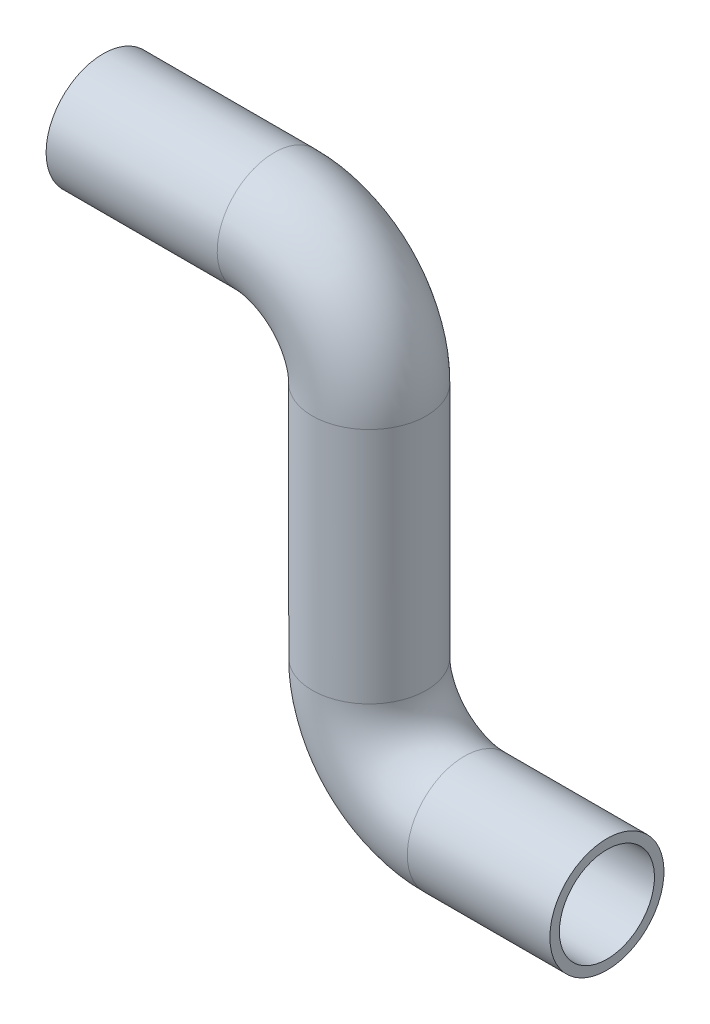
from build123d import *

# Parameters (mm, degrees)
SWEEP_THIN1_PROFILE_R   = 6
SWEEP_THIN1_PROFILE_R_2 = 5


with BuildPart() as part:
    # Sweep-Thin1: sweep along a path in Sketch1
    with BuildLine(Plane.XY) as sweep_thin1_path:
        Line((0, 0), (18, 0))
        ThreePointArc((18, 0), (25.071067812, -2.928932188), (28, -10))
        Line((28, -10), (28, -35))
        ThreePointArc((28, -35), (30.928932188, -42.071067812), (38, -45))
        Line((38, -45), (53, -45))
    # Sweep-Thin1 profile (on start of the path) → Sweep-Thin1 (sweep)
    with BuildSketch(Plane(origin=(0, 0, 0), x_dir=(0, 0, 1), z_dir=(1, 0, 0))):
        Circle(SWEEP_THIN1_PROFILE_R)
        Circle(SWEEP_THIN1_PROFILE_R_2, mode=Mode.SUBTRACT)
    sweep(path=sweep_thin1_path.line)


solid = part.part
